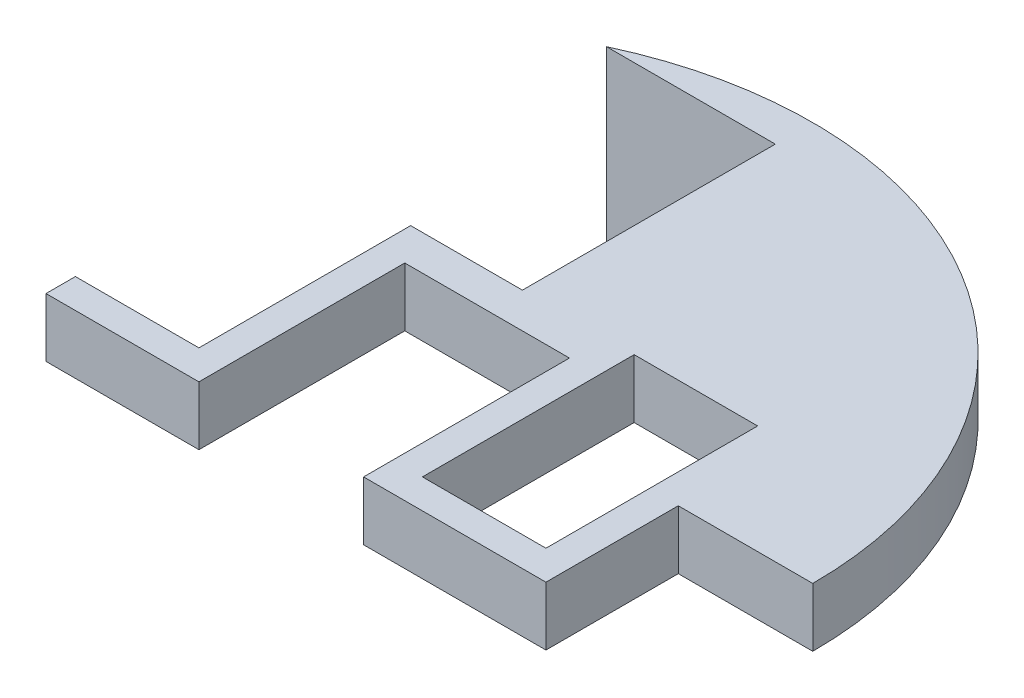
from build123d import *

# Parameters (mm, degrees)
SKETCH2_W           = 21
SKETCH2_H           = 36
BOSS_EXTRUDE1_DEPTH = 10
BOSS_EXTRUDE2_DEPTH = 30


with BuildPart() as part:
    # Sketch2 → Boss-Extrude1 (new body)
    with BuildSketch(Plane(origin=(0, 0, 0), x_dir=(1, 0, 0), z_dir=(0, 1, 0))):
        with BuildLine():
            Line((67.865, 0), (45, 0))
            Line((45, 0), (45, -22.5))
            Line((45, -22.5), (14, -22.5))
            Line((14, -22.5), (14, 12.5))
            Line((14, 12.5), (-14, 12.5))
            Line((-14, 12.5), (-14, -22.5))
            Line((-14, -22.5), (-40, -22.5))
            Line((-40, -22.5), (-40, -17.5))
            Line((-40, -17.5), (-19, -17.5))
            Line((-19, -17.5), (-19, 18.5))
            Line((-19, 18.5), (0, 18.5))
            Line((0, 18.5), (0, 61.5))
            Line((0, 61.5), (-28.695090608, 61.5))
            ThreePointArc((-28.695090608, 61.5), (36.457275686, 57.240940546), (67.865, 0))
        make_face()
        with Locations((29.5, 0.5)):
            Rectangle(SKETCH2_W, SKETCH2_H, mode=Mode.SUBTRACT)
    extrude(amount=BOSS_EXTRUDE1_DEPTH)

    # Sketch3 → Boss-Extrude2 (add)
    with BuildSketch(Plane.XZ):
        Polygon((0, -61.5), (0, -67.865), (-2.244041558, -67.827888825), (-17.609918894, -65.540437758), (-28.695090608, -61.5), align=None)
    extrude(amount=BOSS_EXTRUDE2_DEPTH)


solid = part.part
